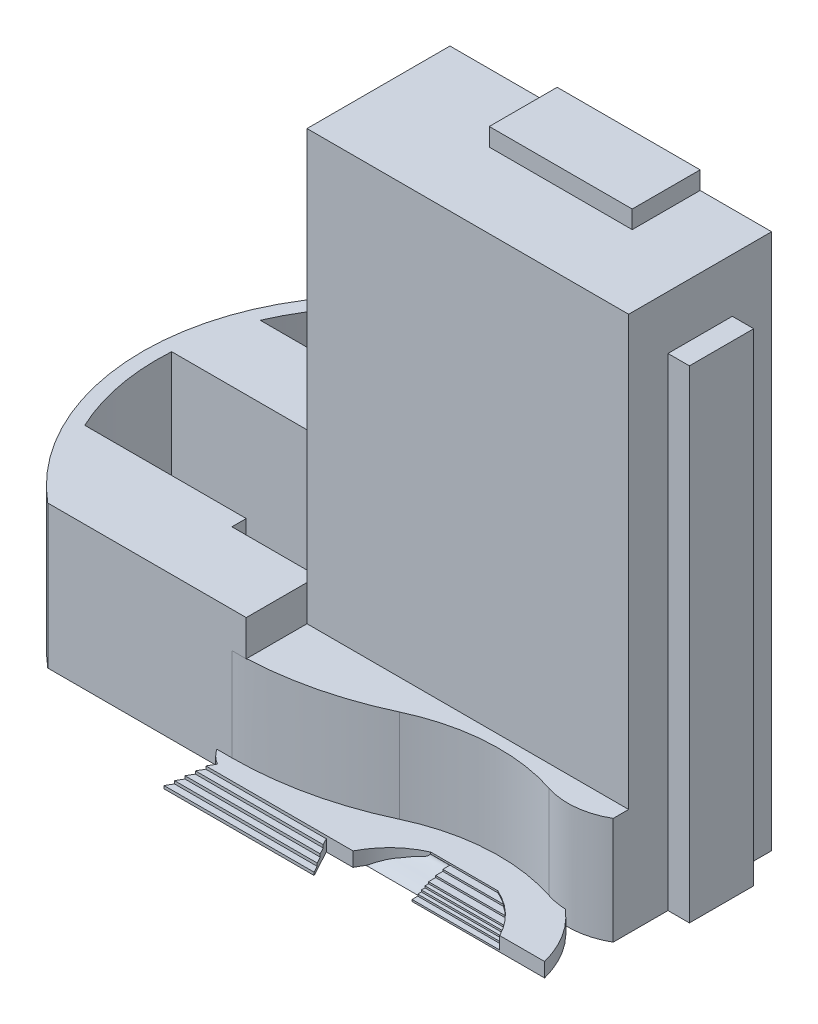
from build123d import *

# Parameters (mm, degrees)
EXTRUDE_1_DEPTH          = 20
EXTRUDE_2_DEPTH          = 75
CUT_EXTRUDE_1_REACH      = 104.675
SKETCH_4_W               = 3
SKETCH_4_H               = 7.5
CUT_EXTRUDE_3_DEPTH      = 15
SKETCH_10_W              = 45
SKETCH_10_H              = 8.5
CUT_EXTRUDE_4_DEPTH      = 5
EXTRUDE_7_DEPTH          = 2
CUT_EXTRUDE_5_REACH      = 99.006
CUT_EXTRUDE_6_DEPTH      = 21
CUT_EXTRUDE_7_REACH      = 99.006
SKETCH_16_R              = 11.5
EXTRUDE_8_DEPTH          = 11
EXTRUDE_8_DEPTH_BACK     = 11
CUT_EXTRUDE_8_REACH      = 106.745
CUT_EXTRUDE_8_END_RADIUS = 11.5
SKETCH_22_W              = 20
SKETCH_22_H              = 9.5
EXTRUDE_9_DEPTH          = 2.5


with BuildPart() as part:
    # 草图1 → 凸台-拉伸1 (new body)
    with BuildSketch(Plane(origin=(0, 0, 0), x_dir=(1, 0, 0), z_dir=(0, 1, 0))):
        with BuildLine():
            Line((-20.766559657, -25), (52, -25))
            Line((52, -25), (52, -15))
            Line((52, -15), (-5, -15))
            Line((-5, -15), (-5, -13))
            Line((-5, -13), (-27.590759323, -13))
            ThreePointArc((-27.590759323, -13), (-29.966289228, -5.680801874), (-30.434355587, 2))
            Line((-30.434355587, 2), (-2, 2))
            Line((-2, 2), (-2, 3.5))
            Line((-2, 3.5), (3, 3.5))
            Line((3, 3.5), (3, 2))
            Line((3, 2), (9, 2))
            Line((9, 2), (9, 12))
            Line((9, 12), (6.5, 12))
            Line((6.5, 12), (6.5, 10))
            Line((6.5, 10), (4.5, 10))
            Line((4.5, 10), (4.5, 12))
            Line((4.5, 12), (-28.040149786, 12))
            ThreePointArc((-28.040149786, 12), (-23.100827955, 19.914862485), (-16, 25.966324345))
            Line((-16, 25.966324345), (-16, 20))
            Line((-16, 20), (9, 20))
            Line((9, 20), (9, 31.228992939))
            ThreePointArc((9, 31.228992939), (-28.723472863, 15.205660351), (-20.766559657, -25))
        make_face()
    extrude(amount=EXTRUDE_1_DEPTH)

    # 草图3 → 凸台-拉伸2 (add)
    with BuildSketch(Plane(origin=(0, 0, 0), x_dir=(1, 0, 0), z_dir=(0, 1, 0))):
        Polygon((7, 3.5), (52, 3.5), (52, -2), (55, -2), (55, -11), (52, -11), (52, -16.5), (7, -16.5), (7, -11), (4, -11), (4, -2), (7, -2), align=None)
    extrude(amount=EXTRUDE_2_DEPTH)

    # 草图4 → 切除-拉伸1 (cut, up to next)
    with BuildSketch(Plane.XY.offset(11), mode=Mode.PRIVATE) as cut_extrude_1_sk1:
        with Locations((5.5, 71.25)):
            Rectangle(SKETCH_4_W, SKETCH_4_H)
    cut_extrude_1_tool1 = extrude(cut_extrude_1_sk1.sketch, amount=-CUT_EXTRUDE_1_REACH, mode=Mode.PRIVATE) & part.part
    # 草图4 → 切除-拉伸1 (cut, up to next)
    with BuildSketch(Plane.XY.offset(11), mode=Mode.PRIVATE) as cut_extrude_1_sk2:
        with Locations((53.5, 71.25)):
            Rectangle(SKETCH_4_W, SKETCH_4_H)
    cut_extrude_1_tool2 = extrude(cut_extrude_1_sk2.sketch, amount=-CUT_EXTRUDE_1_REACH, mode=Mode.PRIVATE) & part.part
    add(cut_extrude_1_tool1.solids().sort_by_distance((5.5, 71.25, 11))[0], mode=Mode.SUBTRACT)
    add(cut_extrude_1_tool2.solids().sort_by_distance((53.5, 71.25, 11))[0], mode=Mode.SUBTRACT)

    # 草图9 → 切除-拉伸3 (cut)
    with BuildSketch(Plane(origin=(0, 0, 0), x_dir=(1, 0, 0), z_dir=(0, 1, 0))):
        with BuildLine():
            Line((52, -25), (52, -18.660254038))
            ThreePointArc((52, -18.660254038), (48.035984141, -19.946192078), (43.892048311, -19.504769134))
            ThreePointArc((43.892048311, -19.504769134), (33.901437956, -18.227421286), (24.144020863, -20.724764765))
            ThreePointArc((24.144020863, -20.724764765), (14.807792452, -23.918187659), (5, -25))
            Line((5, -25), (52, -25))
        make_face()
    extrude(amount=CUT_EXTRUDE_3_DEPTH, mode=Mode.SUBTRACT)

    # 草图10 → 切除-拉伸4 (cut)
    with BuildSketch(Plane(origin=(0, 20, 0), x_dir=(1, 0, 0), z_dir=(0, 1, 0))):
        with Locations((29.5, -20.75)):
            Rectangle(SKETCH_10_W, SKETCH_10_H)
    extrude(amount=-CUT_EXTRUDE_4_DEPTH, mode=Mode.SUBTRACT)

    # 草图11 → 凸台-拉伸7 (add)
    with BuildSketch(Plane(origin=(0, 0, 0), x_dir=(1, 0, 0), z_dir=(0, 1, 0))):
        with BuildLine():
            Line((2, -31.5), (4.744300512, -26.75984457))
            ThreePointArc((4.744300512, -26.75984457), (2.188260872, -20.573315931), (7.5, -16.5))
            Line((7.5, -16.5), (37, -16.5))
            ThreePointArc((37, -16.5), (47.606601718, -20.893398282), (52, -31.5))
            Line((52, -31.5), (2, -31.5))
        make_face()
    extrude(amount=EXTRUDE_7_DEPTH)

    # 草图13 → 切除-拉伸5 (cut, up to next)
    with BuildSketch(Plane(origin=(0, 2, 0), x_dir=(1, 0, 0), z_dir=(0, 1, 0)), mode=Mode.PRIVATE) as cut_extrude_5_sk1:
        Polygon((22.995595677, -31.5), (20.996905673, -27.799311895), (54.018038791, -27.799311895), (54.018038791, -31.5), align=None)
    cut_extrude_5_tool1 = extrude(cut_extrude_5_sk1.sketch, amount=-CUT_EXTRUDE_5_REACH, mode=Mode.PRIVATE) & part.part
    add(cut_extrude_5_tool1.solids().sort_by_distance((38.001947, 2, 29.630407))[0], mode=Mode.SUBTRACT)

    # 草图15 → 切除-拉伸6 (cut)
    with BuildSketch(Plane(origin=(2, 0, 0), x_dir=(0, 0, -1), z_dir=(1, 0, 0))):
        Polygon((-31.5, 0.4), (-30.574311895, 0.4), (-30.574311895, 0.8), (-29.649311895, 0.8), (-29.649311895, 1.2), (-28.724311895, 1.2), (-28.724311895, 1.6), (-27.799311895, 1.6), (-27.799311895, 2), (-31.5, 2), align=None)
    extrude(amount=CUT_EXTRUDE_6_DEPTH, mode=Mode.SUBTRACT)

    # 草图16 → 切除-拉伸7 (cut, up to next)
    with BuildSketch(Plane(origin=(0, 2, 0), x_dir=(1, 0, 0), z_dir=(0, 1, 0)), mode=Mode.PRIVATE) as cut_extrude_7_sk1:
        with Locations((35, -33)):
            Circle(SKETCH_16_R)
    cut_extrude_7_tool1 = extrude(cut_extrude_7_sk1.sketch, amount=-CUT_EXTRUDE_7_REACH, mode=Mode.PRIVATE) & part.part
    add(cut_extrude_7_tool1.solids().sort_by_distance((35, 2, 33))[0], mode=Mode.SUBTRACT)

    # 草图18 → 凸台-拉伸8 (add, two sides: drawn at the far end of the back side and taken through both)
    with BuildSketch(Plane(origin=(35, 0, 0), x_dir=(0, 0, -1), z_dir=(1, 0, 0)).offset(-EXTRUDE_8_DEPTH_BACK)):
        Polygon((-27.799311895, 0.25), (-27.799311895, 0), (-21.5, 0), (-21.5, 2), (-22.5, 2), (-22.5, 1.75), (-23.5, 1.75), (-23.5, 1.5), (-24.5, 1.5), (-24.5, 1.25), (-25.5, 1.25), (-25.5, 1), (-26, 1), (-26, 0.75), (-26.5, 0.75), (-26.5, 0.5), (-27, 0.5), (-27, 0.25), align=None)
    extrude(amount=EXTRUDE_8_DEPTH + EXTRUDE_8_DEPTH_BACK)

    # 切除-拉伸8: up to this cylinder (the profile starts inside it)
    cut_extrude_8_end = Plane(origin=(35, 1.199158, 33), z_dir=(0, 1, 0)) * Cylinder(CUT_EXTRUDE_8_END_RADIUS, 237.49, mode=Mode.PRIVATE)
    # 草图21 → 切除-拉伸8 (cut, up to the surface)
    with BuildSketch(Plane(origin=(33, 0, 0), x_dir=(0, 0, -1), z_dir=(1, 0, 0)), mode=Mode.PRIVATE) as cut_extrude_8_sk1:
        with BuildLine():
            Line((-22.5, 2), (-27.799311895, 2.043691233))
            Line((-27.799311895, 2.043691233), (-27.799311895, 0))
            add(Edge.make_bspline(
                [(-27.799311895, 0), (-27.204791672, -0.222081078), (-26.384663507, 0.078646126), (-25.326854987, 0.456459594), (-24.66401125, 0.700176127), (-24.021132133, 0.799941058), (-23.26371078, 1.202357465), (-22.499729223, 1.183276831), (-22.5, 2)],
                knots=[0, 0, 0, 0, 0.297814847, 0.424941071, 0.570246023, 0.652881605, 0.750360442, 1, 1, 1, 1], degree=3))
        make_face()
    cut_extrude_8_tool1 = extrude(cut_extrude_8_sk1.sketch, amount=-CUT_EXTRUDE_8_REACH, mode=Mode.PRIVATE) & cut_extrude_8_end
    add(cut_extrude_8_tool1.solids().sort_by_distance((33, 1.199158, 25.64967))[0], mode=Mode.SUBTRACT)

    # 草图22 → 凸台-拉伸9 (add)
    with BuildSketch(Plane(origin=(0, 75, 0), x_dir=(1, 0, 0), z_dir=(0, 1, 0))):
        with Locations((32, -1.25)):
            Rectangle(SKETCH_22_W, SKETCH_22_H)
    extrude(amount=EXTRUDE_9_DEPTH)


solid = part.part
